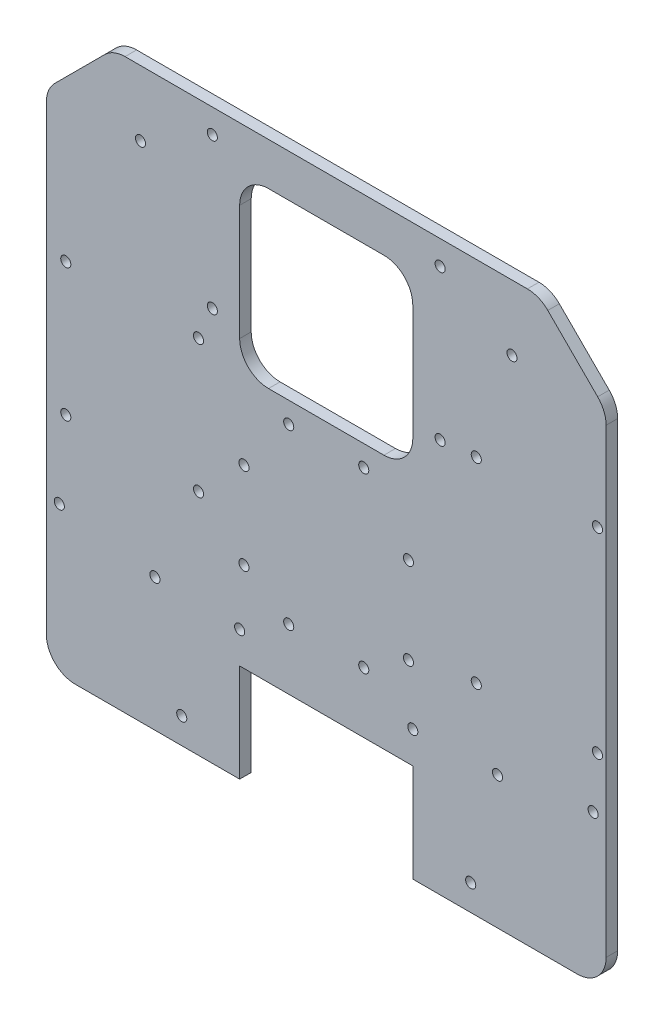
from build123d import *

# Parameters (mm, degrees)
EXTRUDE_1_DEPTH      = 4
SKETCH_6_R           = 1.75
CUT_EXTRUDE_3_DEPTH  = 4
SKETCH_4_R           = 1.75
CUT_EXTRUDE_4_DEPTH  = 4
SKETCH_7_R           = 1.75
CUT_EXTRUDE_5_DEPTH  = 4
SKETCH_8_R           = 1.75
CUT_EXTRUDE_6_DEPTH  = 4
CUT_EXTRUDE_7_DEPTH  = 4
SKETCH_10_R          = 1.75
SKETCH_10_R_2        = 1.749999998
CUT_EXTRUDE_9_DEPTH  = 4
CUT_EXTRUDE_10_REACH = 358.759
SKETCH_11_R          = 1.75
SKETCH_12_R          = 1.75
CUT_EXTRUDE_13_DEPTH = 357.758930869
SKETCH_13_W          = 60
SKETCH_13_H          = 33.978821531
CUT_EXTRUDE_14_DEPTH = 10
SKETCH_14_W          = 60
SKETCH_14_H          = 10
CUT_EXTRUDE_16_DEPTH = 10


with BuildPart() as part:
    # 草图3 → 凸台-拉伸1 (new body)
    with BuildSketch(Plane.XY):
        with BuildLine():
            Line((73.505746565, 259.089488009), (196.937204075, 259.089488009))
            ThreePointArc((196.937204075, 259.089488009), (204.590872722, 257.56707866), (211.079339699, 253.231623633))
            Line((211.079339699, 253.231623633), (239.363610944, 224.947352388))
            ThreePointArc((239.363610944, 224.947352388), (243.69906597, 218.458885412), (245.22147532, 210.805216764))
            Line((245.22147532, 210.805216764), (245.22147532, 54.089488009))
            ThreePointArc((245.22147532, 54.089488009), (239.363610944, 39.947352386), (225.22147532, 34.089488009))
            Line((225.22147532, 34.089488009), (45.221475318, 34.089488009))
            ThreePointArc((45.221475318, 34.089488009), (31.079339694, 39.947352386), (25.221475318, 54.089488009))
            Line((25.221475318, 54.089488009), (25.221475318, 210.805216762))
            ThreePointArc((25.221475318, 210.805216762), (26.743884667, 218.458885409), (31.079339694, 224.947352386))
            Line((31.079339694, 224.947352386), (59.363610941, 253.231623633))
            ThreePointArc((59.363610941, 253.231623633), (65.852077918, 257.56707866), (73.505746565, 259.089488009))
        make_face()
    extrude(amount=EXTRUDE_1_DEPTH)

    # 草图6 → 切除-拉伸3 (cut)
    with BuildSketch(Plane.XY.offset(4)):
        with Locations((187.22147532, 181.720072532)):
            Circle(SKETCH_6_R)
        with Locations((229.22147532, 181.720072532)):
            Circle(SKETCH_6_R)
        with Locations((229.22147532, 113.880072532)):
            Circle(SKETCH_6_R)
        with Locations((187.22147532, 113.880072532)):
            Circle(SKETCH_6_R)
    extrude(amount=-CUT_EXTRUDE_3_DEPTH, mode=Mode.SUBTRACT)

    # 草图4 → 切除-拉伸4 (cut)
    with BuildSketch(Plane.XY.offset(4)):
        with Locations((174.691475319, 232.74535793)):
            Circle(SKETCH_4_R)
        with Locations(Location((174.691475319, 180.63535793, 0), (0, 0, 180))):
            Circle(SKETCH_4_R)
        with Locations((95.751475319, 180.63535793)):
            Circle(SKETCH_4_R)
        with Locations(Location((95.751475319, 232.74535793, 0), (0, 0, 180))):
            Circle(SKETCH_4_R)
        with Locations((165.22147532, 89.06830954)):
            Circle(SKETCH_4_R)
        with Locations(Location((105.22147532, 89.06830954, 0), (0, 0, 180))):
            Circle(SKETCH_4_R)
    extrude(amount=-CUT_EXTRUDE_4_DEPTH, mode=Mode.SUBTRACT)

    # 草图7 → 切除-拉伸5 (cut)
    with BuildSketch(Plane.XY.offset(4)):
        with Locations((122.221475319, 159.089488009)):
            Circle(SKETCH_7_R)
        with Locations((148.221475319, 159.089488009)):
            Circle(SKETCH_7_R)
        with Locations((122.221475319, 99.089488009)):
            Circle(SKETCH_7_R)
        with Locations((148.221475319, 99.089488009)):
            Circle(SKETCH_7_R)
    extrude(amount=-CUT_EXTRUDE_5_DEPTH, mode=Mode.SUBTRACT)

    # 草图8 → 切除-拉伸6 (cut)
    with BuildSketch(Plane.XY.offset(4)):
        with Locations((227.720064334, 95.494716411)):
            Circle(SKETCH_8_R)
        with Locations((185.293657462, 53.06830954)):
            Circle(SKETCH_8_R)
        with Locations(Location((42.722886307, 95.494716411, 0), (0, 0, 180))):
            Circle(SKETCH_8_R)
        with Locations(Location((85.149293178, 53.06830954, 0), (0, 0, 180))):
            Circle(SKETCH_8_R)
    extrude(amount=-CUT_EXTRUDE_6_DEPTH, mode=Mode.SUBTRACT)

    # 草图9 → 切除-拉伸7 (cut)
    with BuildSketch(Plane.XY.offset(4)):
        with BuildLine():
            Line((115.22147532, 166.324698125), (155.22147532, 166.324698125))
            ThreePointArc((155.22147532, 166.324698125), (162.292543132, 169.253630313), (165.22147532, 176.324698125))
            Line((165.22147532, 176.324698125), (165.22147532, 216.324698125))
            ThreePointArc((165.22147532, 216.324698125), (162.292543132, 223.395765937), (155.22147532, 226.324698125))
            Line((155.22147532, 226.324698125), (135.22147532, 226.324698125))
            Line((135.22147532, 226.324698125), (115.22147532, 226.324698125))
            ThreePointArc((115.22147532, 226.324698125), (108.150407508, 223.395765937), (105.22147532, 216.324698125))
            Line((105.22147532, 216.324698125), (105.22147532, 196.104283633))
            Line((105.22147532, 196.104283633), (105.22147532, 176.324698125))
            ThreePointArc((105.22147532, 176.324698125), (108.150407508, 169.253630313), (115.22147532, 166.324698125))
        make_face()
    extrude(amount=-CUT_EXTRUDE_7_DEPTH, mode=Mode.SUBTRACT)

    # 草图10 → 切除-拉伸9 (cut)
    with BuildSketch(Plane.XY.offset(4)):
        with Locations((106.721475319, 109.089488009)):
            Circle(SKETCH_10_R)
        with Locations((163.721475321, 109.089488009)):
            Circle(SKETCH_10_R_2)
        with Locations((106.721475319, 139.089488009)):
            Circle(SKETCH_10_R)
        with Locations(Location((163.721475321, 139.089488009, 0), (0, 0, 180))):
            Circle(SKETCH_10_R)
    extrude(amount=-CUT_EXTRUDE_9_DEPTH, mode=Mode.SUBTRACT)

    # 草图11 → 切除-拉伸10 (cut, up to next)
    with BuildSketch(Plane.XY.offset(4), mode=Mode.PRIVATE) as cut_extrude_10_sk1:
        with Locations((70.852077918, 218.458885409)):
            Circle(SKETCH_11_R)
    cut_extrude_10_tool1 = extrude(cut_extrude_10_sk1.sketch, amount=-CUT_EXTRUDE_10_REACH, mode=Mode.PRIVATE) & part.part
    # 草图11 → 切除-拉伸10 (cut, up to next)
    with BuildSketch(Plane.XY.offset(4), mode=Mode.PRIVATE) as cut_extrude_10_sk2:
        with Locations((75.852077918, 90.084611013)):
            Circle(SKETCH_11_R)
    cut_extrude_10_tool2 = extrude(cut_extrude_10_sk2.sketch, amount=-CUT_EXTRUDE_10_REACH, mode=Mode.PRIVATE) & part.part
    # 草图11 → 切除-拉伸10 (cut, up to next)
    with BuildSketch(Plane.XY.offset(4), mode=Mode.PRIVATE) as cut_extrude_10_sk3:
        with Locations((194.590872722, 90.084611013)):
            Circle(SKETCH_11_R)
    cut_extrude_10_tool3 = extrude(cut_extrude_10_sk3.sketch, amount=-CUT_EXTRUDE_10_REACH, mode=Mode.PRIVATE) & part.part
    # 草图11 → 切除-拉伸10 (cut, up to next)
    with BuildSketch(Plane.XY.offset(4), mode=Mode.PRIVATE) as cut_extrude_10_sk4:
        with Locations((199.590872722, 218.458885409)):
            Circle(SKETCH_11_R)
    cut_extrude_10_tool4 = extrude(cut_extrude_10_sk4.sketch, amount=-CUT_EXTRUDE_10_REACH, mode=Mode.PRIVATE) & part.part
    add(cut_extrude_10_tool1.solids().sort_by_distance((70.852078, 218.458885, 4))[0], mode=Mode.SUBTRACT)
    add(cut_extrude_10_tool2.solids().sort_by_distance((75.852078, 90.084611, 4))[0], mode=Mode.SUBTRACT)
    add(cut_extrude_10_tool3.solids().sort_by_distance((194.590873, 90.084611, 4))[0], mode=Mode.SUBTRACT)
    add(cut_extrude_10_tool4.solids().sort_by_distance((199.590873, 218.458885, 4))[0], mode=Mode.SUBTRACT)

    # 草图12 → 切除-拉伸13 (cut, through all)
    with BuildSketch(Plane.XY.offset(4)):
        with Locations((90.961423691, 169.312171827)):
            Circle(SKETCH_12_R)
        with Locations((90.961423691, 123.312171827)):
            Circle(SKETCH_12_R)
        with Locations((44.961423691, 123.312171827)):
            Circle(SKETCH_12_R)
        with Locations((44.961423691, 169.312171827)):
            Circle(SKETCH_12_R)
    extrude(amount=-CUT_EXTRUDE_13_DEPTH, mode=Mode.SUBTRACT)

    # 草图13 → 切除-拉伸14 (cut)
    with BuildSketch(Plane.XY.offset(4)):
        with Locations((135.22147532, 51.078898775)):
            Rectangle(SKETCH_13_W, SKETCH_13_H)
    extrude(amount=-CUT_EXTRUDE_14_DEPTH, mode=Mode.SUBTRACT)

    # 草图14 → 切除-拉伸16 (cut)
    with BuildSketch(Plane.XY):
        with BuildLine():
            Line((38.221475318, 210.805216762), (38.221475318, 213.805216762))
            ThreePointArc((38.221475318, 213.805216762), (38.982679993, 217.632051085), (41.150407506, 220.876284574))
            Line((41.150407506, 220.876284574), (58.434678753, 238.160555821))
            ThreePointArc((58.434678753, 238.160555821), (61.678912242, 240.328283334), (65.505746565, 241.089488009))
            Line((65.505746565, 241.089488009), (73.505746565, 241.089488009))
            Line((73.505746565, 241.089488009), (196.937204075, 241.089488009))
            Line((196.937204075, 241.089488009), (204.937204075, 241.089488009))
            ThreePointArc((204.937204075, 241.089488009), (208.764038399, 240.328283334), (212.008271887, 238.160555821))
            Line((212.008271887, 238.160555821), (229.292543132, 220.876284576))
            ThreePointArc((229.292543132, 220.876284576), (231.460270645, 217.632051088), (232.22147532, 213.805216764))
            Line((232.22147532, 213.805216764), (232.22147532, 54.089488009))
            ThreePointArc((232.22147532, 54.089488009), (229.292543132, 47.018420197), (222.22147532, 44.089488009))
            Line((222.22147532, 44.089488009), (175.22147532, 44.089488009))
            Line((175.22147532, 44.089488009), (165.22147532, 44.089488009))
            Line((165.22147532, 44.089488009), (165.22147532, 34.089488009))
            Line((165.22147532, 34.089488009), (225.22147532, 34.089488009))
            ThreePointArc((225.22147532, 34.089488009), (239.363610944, 39.947352386), (245.22147532, 54.089488009))
            Line((245.22147532, 54.089488009), (245.22147532, 210.805216764))
            ThreePointArc((245.22147532, 210.805216764), (243.69906597, 218.458885412), (239.363610944, 224.947352388))
            Line((239.363610944, 224.947352388), (211.079339699, 253.231623633))
            ThreePointArc((211.079339699, 253.231623633), (204.590872722, 257.56707866), (196.937204075, 259.089488009))
            Line((196.937204075, 259.089488009), (73.505746565, 259.089488009))
            ThreePointArc((73.505746565, 259.089488009), (65.852077918, 257.56707866), (59.363610941, 253.231623633))
            Line((59.363610941, 253.231623633), (31.079339694, 224.947352386))
            ThreePointArc((31.079339694, 224.947352386), (26.743884667, 218.458885409), (25.221475318, 210.805216762))
            Line((25.221475318, 210.805216762), (25.221475318, 54.089488009))
            ThreePointArc((25.221475318, 54.089488009), (31.079339694, 39.947352386), (45.221475318, 34.089488009))
            Line((45.221475318, 34.089488009), (105.22147532, 34.089488009))
            Line((105.22147532, 34.089488009), (105.22147532, 44.089488009))
            Line((105.22147532, 44.089488009), (95.22147532, 44.089488009))
            Line((95.22147532, 44.089488009), (48.221475318, 44.089488009))
            ThreePointArc((48.221475318, 44.089488009), (41.150407506, 47.018420197), (38.221475318, 54.089488009))
            Line((38.221475318, 54.089488009), (38.221475318, 210.805216762))
        make_face()
        with Locations((135.22147532, 73.06830954)):
            Rectangle(SKETCH_14_W, SKETCH_14_H)
    extrude(amount=CUT_EXTRUDE_16_DEPTH, mode=Mode.SUBTRACT)


solid = part.part
